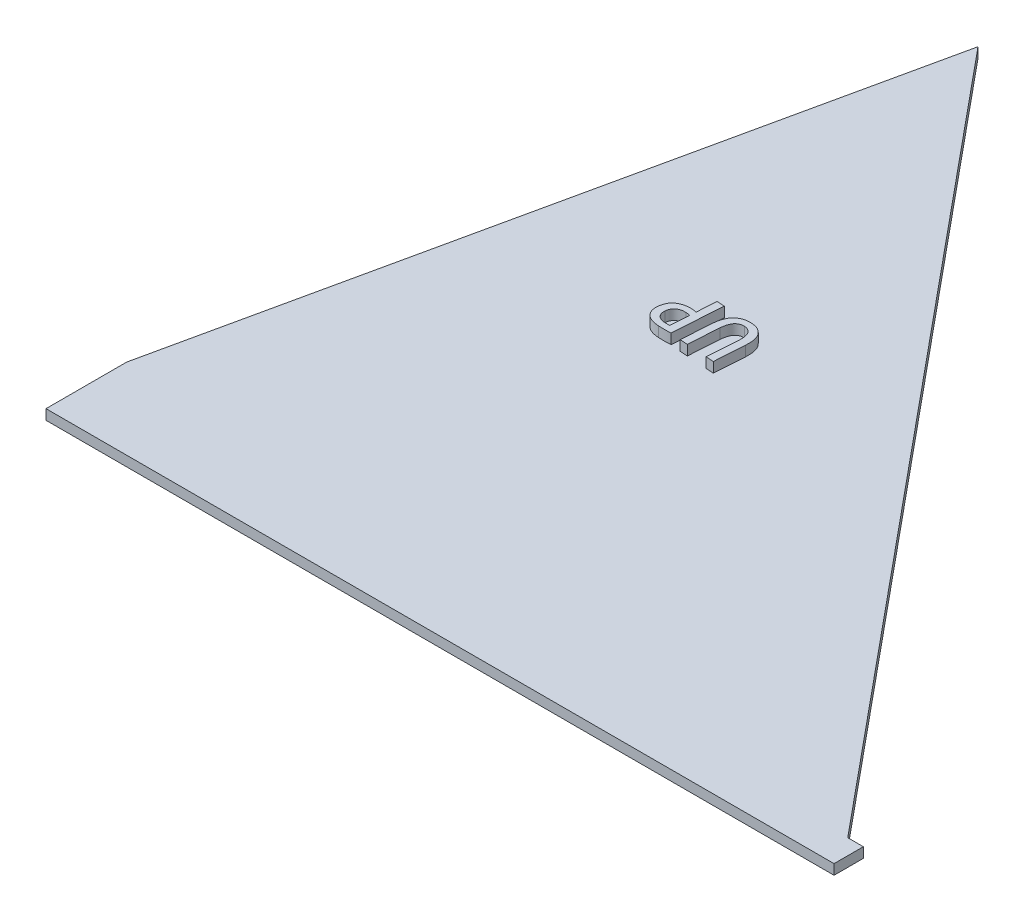
from build123d import *

# Parameters (mm, degrees)
EXTRUDE_1_DEPTH = 1
EXTRUDE_2_DEPTH = 1


with BuildPart() as part:
    # 草图1 → 凸台-拉伸1 (new body)
    with BuildSketch(Plane(origin=(0, 0, 0), x_dir=(1, 0, 0), z_dir=(0, 1, 0))):
        Polygon((2.736696129, 9.473412041), (16.58017542, 72.883143872), (77.860885248, -1.274015551), (79.4026, -1.274015551), (79.4026, -4.17), (1.5, -4.17), (1.5, 3.808754461), align=None)
    extrude(amount=EXTRUDE_1_DEPTH)

    # 草图2 → 凸台-拉伸2 (add)
    # profile 1 of 2: a face of its own
    with BuildSketch(Plane.XZ.offset(-1)):
        with BuildLine():
            Line((27.247178656, -37.134108742), (26.498069264, -37.184070121))
            Line((26.498069264, -37.184070121), (26.367735231, -35.229871707))
            add(Edge.make_bspline(
                [(26.367735231, -35.229871707), (26.336136972, -35.237959723), (26.270940383, -35.254647701), (26.168685096, -35.271305323), (26.06001111, -35.283910157), (25.985459776, -35.288939032), (25.947055355, -35.291529611)],
                knots=[0, 0, 0, 0, 0.918524269, 1.895188248, 2.915725933, 4, 4, 4, 4], degree=3))
            add(Edge.make_bspline(
                [(25.947055355, -35.291529611), (25.888971534, -35.295059263), (25.773910138, -35.302051343), (25.602623819, -35.297682043), (25.435001026, -35.282463383), (25.271332319, -35.25320731), (25.111285307, -35.21277006), (24.954612218, -35.160015392), (24.802048503, -35.094230317), (24.653616239, -35.017919209), (24.513272279, -34.927178562), (24.389160738, -34.815143767), (24.279568532, -34.686737032), (24.186443183, -34.540279182), (24.109248199, -34.376664865), (24.048793797, -34.195673673), (24.00163799, -33.997727925), (23.98455536, -33.858833633), (23.975706741, -33.786887875)],
                knots=[0, 0, 0, 0, 0.996278886, 1.973582945, 2.931399707, 3.876509745, 4.818088033, 5.756508938, 6.704738743, 7.661035354, 8.613001496, 9.557911395, 10.514025425, 11.496214958, 12.521468463, 13.604750262, 14.759286266, 16, 16, 16, 16], degree=3))
            add(Edge.make_bspline(
                [(23.975706741, -33.786887875), (23.973452918, -33.730795501), (23.969040147, -33.620971923), (23.981295878, -33.459643046), (24.008316205, -33.30606268), (24.051249008, -33.160965902), (24.106879389, -33.024846473), (24.176026658, -32.899197677), (24.256208333, -32.783062463), (24.320948784, -32.715703234), (24.35321277, -32.682134156)],
                knots=[0, 0, 0, 0, 1.117887841, 2.188718949, 3.216803733, 4.219776148, 5.198259829, 6.140927987, 7.073514742, 8, 8, 8, 8], degree=3))
            add(Edge.make_bspline(
                [(24.35321277, -32.682134156), (24.390372306, -32.647075002), (24.465903781, -32.575812818), (24.597971222, -32.486883084), (24.743773905, -32.407877723), (24.905322916, -32.340638498), (25.082570482, -32.286184948), (25.274941514, -32.242813813), (25.482676378, -32.20986596), (25.626939116, -32.198747031), (25.701450626, -32.193004119)],
                knots=[0, 0, 0, 0, 0.835515405, 1.698291186, 2.597844701, 3.548800166, 4.558778601, 5.631012435, 6.776421119, 8, 8, 8, 8], degree=3))
            add(Edge.make_bspline(
                [(25.701450626, -32.193004119), (25.763647746, -32.18990621), (25.884969005, -32.183863452), (26.061872954, -32.178079125), (26.228994693, -32.176297304), (26.386085383, -32.175276922), (26.533358419, -32.180136733), (26.671037915, -32.185786151), (26.798547568, -32.19637649), (26.880137368, -32.205823077), (26.919139372, -32.210338786)],
                knots=[0, 0, 0, 0, 1.225714187, 2.39086934, 3.483452773, 4.515316552, 5.482438301, 6.383408239, 7.227227922, 8, 8, 8, 8], degree=3))
            Line((26.919139372, -32.210338786), (27.247178656, -37.134108742))
        make_face()
        with BuildLine():
            add(Edge.make_bspline(
                [(26.205686584, -32.800151678), (26.176079833, -32.796164938), (26.108374661, -32.787048001), (25.99329716, -32.783062649), (25.852753393, -32.782701532), (25.750681695, -32.786552967), (25.695306953, -32.788642403)],
                knots=[0, 0, 0, 0, 0.700870625, 1.60276173, 2.699478359, 4, 4, 4, 4], degree=3))
            add(Edge.make_bspline(
                [(25.695306953, -32.788642403), (25.657932433, -32.791833077), (25.58475194, -32.798080519), (25.478477782, -32.816141959), (25.378387391, -32.84124998), (25.283896528, -32.871209194), (25.196224059, -32.909838569), (25.115210741, -32.955481345), (25.03925353, -33.006155967), (24.970876759, -33.065156289), (24.909669441, -33.130586372), (24.856775337, -33.202660022), (24.814150815, -33.281632292), (24.778453834, -33.366335047), (24.754586229, -33.458484944), (24.738023638, -33.556671393), (24.729630946, -33.661109096), (24.731926616, -33.732692134), (24.733106875, -33.769494709)],
                knots=[0, 0, 0, 0, 1.15558629, 2.262674533, 3.317300313, 4.333814689, 5.313668358, 6.26345259, 7.196628822, 8.12266155, 9.039750842, 9.952722527, 10.868938376, 11.799486507, 12.778234057, 13.794331363, 14.866012282, 16, 16, 16, 16], degree=3))
            add(Edge.make_bspline(
                [(24.733106875, -33.769494709), (24.737096219, -33.808354477), (24.744855943, -33.883941104), (24.765532333, -33.993323197), (24.796982251, -34.094527148), (24.834175778, -34.189173984), (24.883030807, -34.274790461), (24.938222836, -34.354330579), (25.003166703, -34.425471317), (25.076160949, -34.48869148), (25.15623493, -34.544138738), (25.243910401, -34.590592199), (25.33838039, -34.628357489), (25.438808525, -34.659340274), (25.546631026, -34.679604309), (25.6607371, -34.69332827), (25.781865267, -34.696662397), (25.864468434, -34.693317664), (25.906870167, -34.69160075)],
                knots=[0, 0, 0, 0, 1.106707454, 2.152670698, 3.147355285, 4.106207412, 5.027575719, 5.933648193, 6.84458558, 7.748722376, 8.664759674, 9.598405993, 10.553638462, 11.544030495, 12.57124846, 13.657767573, 14.797688756, 16, 16, 16, 16], degree=3))
            add(Edge.make_bspline(
                [(25.906870167, -34.69160075), (25.948454683, -34.689062607), (26.027460929, -34.684240401), (26.139157586, -34.670071787), (26.238651685, -34.652463648), (26.299233543, -34.633690353), (26.327848462, -34.624823072)],
                knots=[0, 0, 0, 0, 1.169113496, 2.221193815, 3.159807954, 4, 4, 4, 4], degree=3))
            Line((26.327848462, -34.624823072), (26.205686584, -32.800151678))
        make_face(mode=Mode.SUBTRACT)
    # profile 2 of 2: a face of its own
    with BuildSketch(Plane.XZ.offset(-1)):
        with BuildLine():
            Line((27.935432574, -32.083430945), (28.691055961, -32.033035119))
            Line((28.691055961, -32.033035119), (28.892204819, -35.049014672))
            add(Edge.make_bspline(
                [(28.892204819, -35.049014672), (28.897507047, -35.108369157), (28.90777105, -35.223266999), (28.932979911, -35.388569892), (28.964110993, -35.541441954), (29.003735435, -35.681075959), (29.049877232, -35.80835476), (29.1038274, -35.922731741), (29.166322232, -36.023827925), (29.235308242, -36.112819124), (29.311927252, -36.188595136), (29.393405004, -36.254014097), (29.481306787, -36.307626326), (29.575139181, -36.34943819), (29.674153705, -36.380669278), (29.77898, -36.398543183), (29.88926244, -36.40743298), (29.964575532, -36.403749393), (30.003206868, -36.401859922)],
                knots=[0, 0, 0, 0, 1.439721744, 2.786999531, 4.038482243, 5.207354554, 6.291223817, 7.306895795, 8.257373748, 9.158006139, 10.021101694, 10.855396504, 11.677909811, 12.501584238, 13.332400486, 14.17961271, 15.066244781, 16, 16, 16, 16], degree=3))
            add(Edge.make_bspline(
                [(30.003206868, -36.401859922), (30.038729559, -36.398923305), (30.108621995, -36.393145384), (30.209684602, -36.370152125), (30.305513155, -36.33941236), (30.39396647, -36.294571366), (30.477851847, -36.242257996), (30.554413819, -36.177580795), (30.625625293, -36.103498895), (30.690312721, -36.018648553), (30.748019791, -35.922099382), (30.795846408, -35.813332953), (30.835215343, -35.692799841), (30.864869703, -35.56043382), (30.885460677, -35.416124074), (30.896184878, -35.260061022), (30.900103493, -35.091966457), (30.894877985, -34.976148439), (30.89216671, -34.916055829)],
                knots=[0, 0, 0, 0, 0.874153846, 1.719935635, 2.538919661, 3.33858121, 4.148201754, 4.961360028, 5.792268906, 6.667174948, 7.575383943, 8.547579609, 9.578266644, 10.684296341, 11.873995655, 13.154059738, 14.523373295, 16, 16, 16, 16], degree=3))
            Line((30.89216671, -34.916055829), (30.690852339, -31.899659959))
            Line((30.690852339, -31.899659959), (31.446475726, -31.849264133))
            Line((31.446475726, -31.849264133), (31.644583456, -34.819645723))
            add(Edge.make_bspline(
                [(31.644583456, -34.819645723), (31.648578386, -34.909049834), (31.656279514, -35.081396411), (31.647945267, -35.331247935), (31.626567199, -35.562863946), (31.588387672, -35.776491181), (31.535946157, -35.972611101), (31.467518593, -36.150749447), (31.382473647, -36.310338583), (31.282123362, -36.451459106), (31.168931277, -36.575879794), (31.045026327, -36.685519975), (30.909366494, -36.779545606), (30.762799952, -36.858191677), (30.605635955, -36.922509938), (30.437166438, -36.970123465), (30.258184476, -37.004084934), (30.134610832, -37.01396111), (30.071432155, -37.019010437)],
                knots=[0, 0, 0, 0, 1.392410449, 2.68418501, 3.887439475, 5.009764914, 6.057622654, 7.042685123, 7.97321012, 8.864539029, 9.730657168, 10.585789343, 11.434193697, 12.293614102, 13.169840523, 14.071727903, 15.014145116, 16, 16, 16, 16], degree=3))
            add(Edge.make_bspline(
                [(30.071432155, -37.019010437), (30.005641486, -37.022210067), (29.876827974, -37.028474717), (29.687187359, -37.019546443), (29.506284369, -36.993457544), (29.334867231, -36.949141616), (29.172110457, -36.889501605), (29.017921074, -36.813602283), (28.873390267, -36.719534025), (28.737918252, -36.609392285), (28.612277586, -36.481652914), (28.503727367, -36.331489281), (28.405978482, -36.163774568), (28.323255189, -35.975917378), (28.255263986, -35.767835389), (28.199330237, -35.541157099), (28.158249949, -35.294314561), (28.141696756, -35.123047155), (28.133118143, -35.034288632)],
                knots=[0, 0, 0, 0, 1.000276318, 1.958470843, 2.879248422, 3.77219387, 4.643297829, 5.508534547, 6.377296365, 7.25736848, 8.156904209, 9.090557831, 10.064428775, 11.101560789, 12.202301066, 13.386404782, 14.645516639, 16, 16, 16, 16], degree=3))
            Line((28.133118143, -35.034288632), (27.935432574, -32.083430945))
        make_face()
    extrude(amount=-EXTRUDE_2_DEPTH)


solid = part.part
